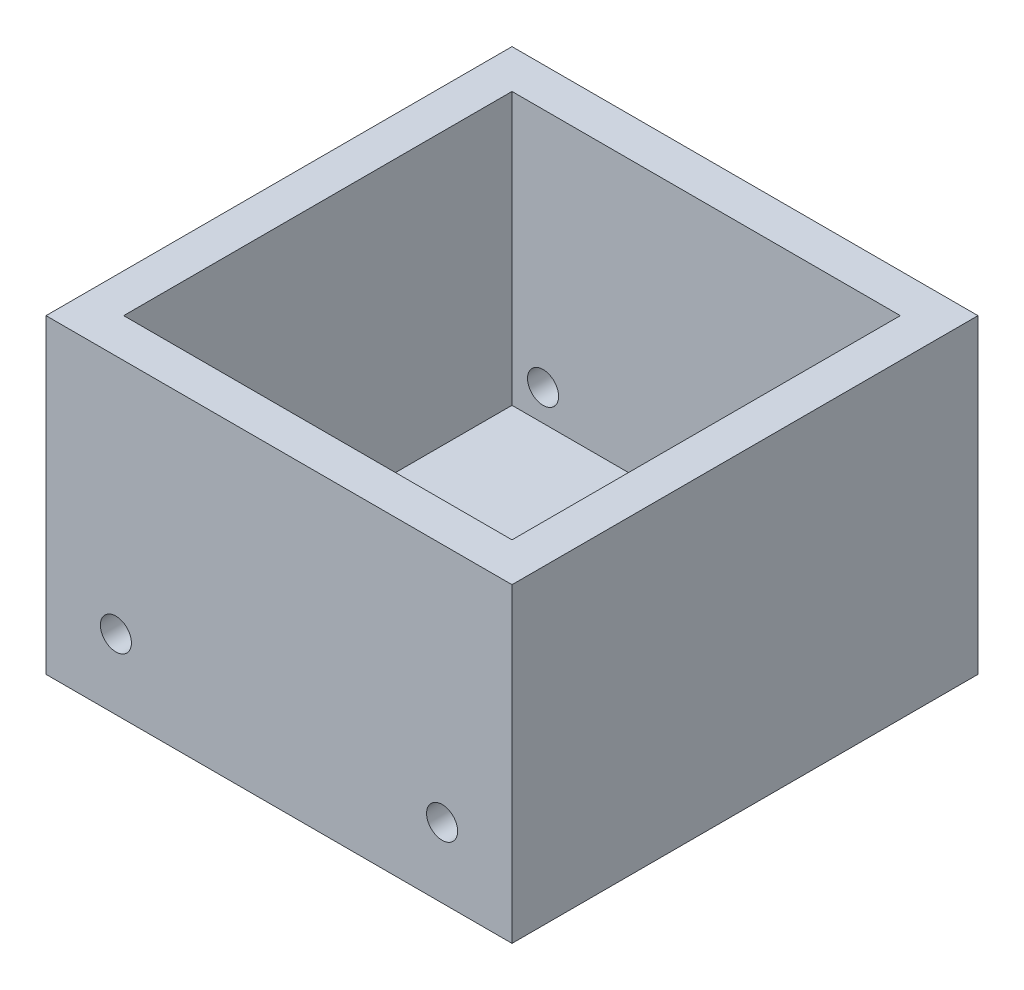
from build123d import *

# Parameters (mm, degrees)
SKETCH1_W           = 152.4
SKETCH1_H           = 152.4
BOSS_EXTRUDE1_DEPTH = 101.6
SHELL1_T            = -12.7
SKETCH2_R           = 5.08
CUT_EXTRUDE1_DEPTH  = 189.799073091


with BuildPart() as part:
    # Sketch1 → Boss-Extrude1 (new body)
    with BuildSketch(Plane(origin=(0, 0, 0), x_dir=(1, 0, 0), z_dir=(0, 1, 0))):
        Rectangle(SKETCH1_W, SKETCH1_H)
    extrude(amount=BOSS_EXTRUDE1_DEPTH)

    # Shell1
    shell1_openings = [part.faces().sort_by_distance(p)[0] for p in [
        (0, 101.6, 0),
    ]]
    offset(amount=SHELL1_T, openings=shell1_openings, kind=Kind.INTERSECTION)

    # Sketch2 → Cut-Extrude1 (cut, through all)
    with BuildSketch(Plane.XY.offset(-63.5)):
        with Locations(Location((-53.34, 22.86, 0), (0, 0, 180))):
            Circle(SKETCH2_R)
        with Locations(Location((53.34, 22.86, 0), (0, 0, 180))):
            Circle(SKETCH2_R)
    cut_extrude1 = extrude(amount=CUT_EXTRUDE1_DEPTH, mode=Mode.SUBTRACT)

    # Mirror1: Cut-Extrude1 across plane
    add(cut_extrude1.mirror(Plane.XY), mode=Mode.SUBTRACT)


solid = part.part
